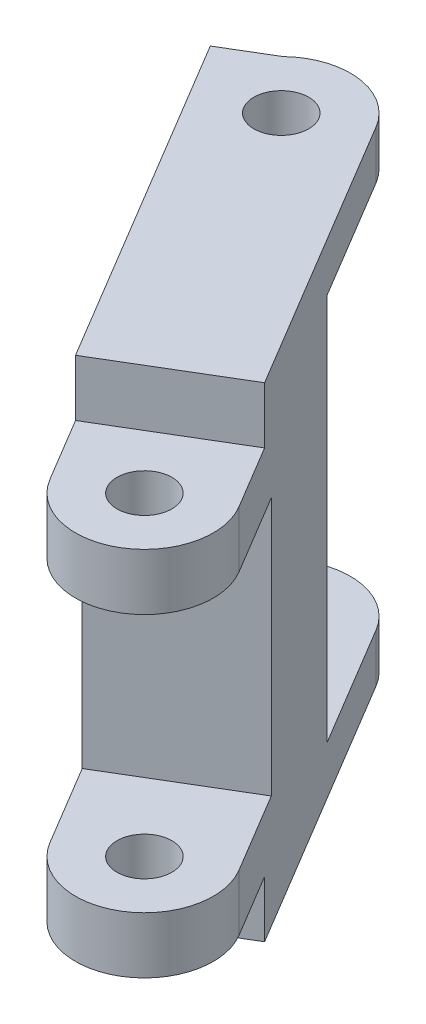
from build123d import *

# Parameters (mm, degrees)
SKETCH1_R           = 1.7
BOSS_EXTRUDE1_DEPTH = 30
SKETCH2_W           = 13
SKETCH2_H           = 24
SKETCH2_W_2         = 7.133537961
CUT_EXTRUDE2_DEPTH  = 30
SKETCH3_W           = 16.393620584
SKETCH3_H           = 16
CUT_EXTRUDE3_DEPTH  = 30
CUT_EXTRUDE4_DEPTH  = 3.5
CUT_EXTRUDE5_DEPTH  = 78.230456788


with BuildPart() as part:
    # Sketch1 → Boss-Extrude1 (new body)
    with BuildSketch(Plane(origin=(0, 0, 0), x_dir=(1, 0, 0), z_dir=(0, 1, 0))):
        with BuildLine():
            Line((0.547347337, 46.773363131), (-12.096275709, 67.916751063))
            ThreePointArc((-12.096275709, 67.916751063), (-15.207212104, 69.964878097), (-18.746235825, 68.803817933))
            Line((-18.746235825, 68.803817933), (-21.570135396, 67.115142409))
            Line((-21.570135396, 67.115142409), (-6.784148434, 42.389171288))
            ThreePointArc((-6.784148434, 42.389171288), (-0.926304627, 40.915519323), (0.547347337, 46.773363131))
        make_face()
        with Locations(Location((-3.118400548, 44.581267209, 0), (0, 0, 270))):
            Circle(SKETCH1_R, mode=Mode.SUBTRACT)
        with Locations(Location((-15.773770801, 65.71763038, 0), (0, 0, 270))):
            Circle(SKETCH1_R, mode=Mode.SUBTRACT)
    extrude(amount=BOSS_EXTRUDE1_DEPTH)

    # Sketch2 → Cut-Extrude2 (cut)
    with BuildSketch(Plane(origin=(13.674403301, 0, -8.177213665), x_dir=(0.5132293910361586, 0, 0.8582514737398672), z_dir=(-0.8582514737398672, 0, 0.5132293910361586))):
        with Locations((-62.172097336, 15)):
            Rectangle(SKETCH2_W, SKETCH2_H)
        with Locations((-72.238866317, 15)):
            Rectangle(SKETCH2_W_2, SKETCH2_H)
    extrude(amount=-CUT_EXTRUDE2_DEPTH, mode=Mode.SUBTRACT)

    # Sketch3 → Cut-Extrude3 (cut)
    with BuildSketch(Plane(origin=(13.674403301, 0, -8.177213665), x_dir=(0.5132293910361586, 0, 0.8582514737398672), z_dir=(-0.8582514737398672, 0, 0.5132293910361586))):
        with Locations((-37.475287044, 15)):
            Rectangle(SKETCH3_W, SKETCH3_H)
    extrude(amount=-CUT_EXTRUDE3_DEPTH, mode=Mode.SUBTRACT)

    # Sketch7 → Cut-Extrude4 (cut)
    with BuildSketch(Plane(origin=(0, 0, 0), x_dir=(-1, 0, 0), z_dir=(0, -1, 0))):
        Polygon((1.817751365, 50.728416138), (9.149247136, 46.344224296), (4.210618406, 38.085567524), (-3.391020631, 42.018010382), align=None)
    extrude(amount=-CUT_EXTRUDE4_DEPTH, mode=Mode.SUBTRACT)

    # Sketch9 → Cut-Extrude5 (cut, through all)
    with BuildSketch(Plane(origin=(13.674403301, 0, -8.177213665), x_dir=(0.5132293910361586, 0, 0.8582514737398672), z_dir=(-0.8582514737398672, 0, 0.5132293910361586))):
        Polygon((-44.470661337, 30), (-44.470661337, 26.5), (-33.41668301, 26.5), (-33.41668301, 30.544862053), (-44.470661337, 30.544862053), align=None)
    extrude(amount=-CUT_EXTRUDE5_DEPTH, mode=Mode.SUBTRACT)


solid = part.part
